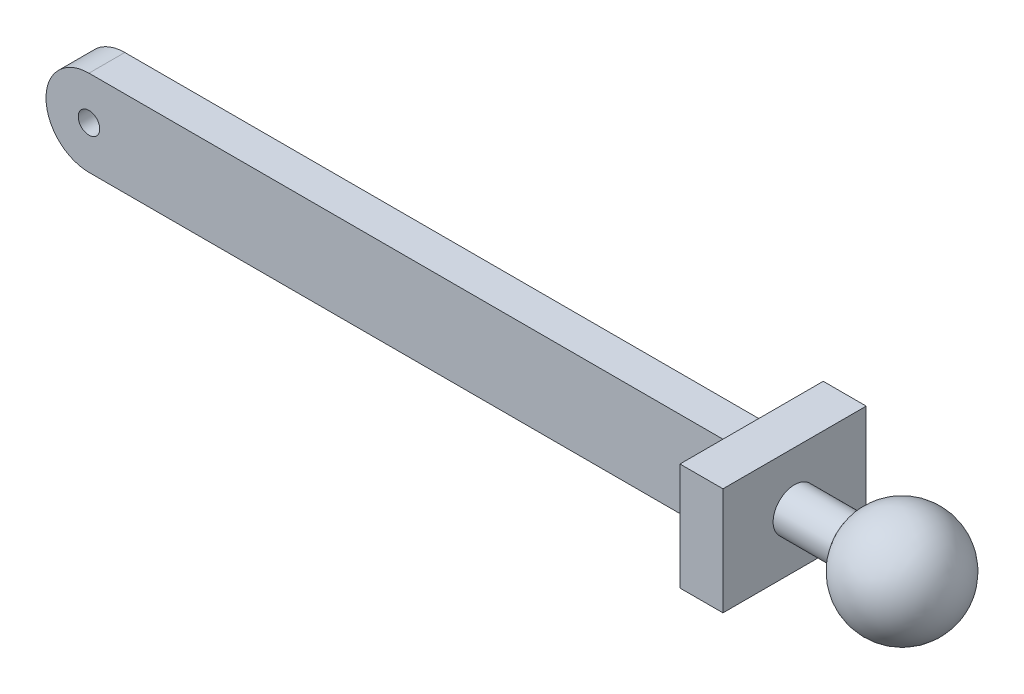
from build123d import *

# Parameters (mm, degrees)
SKETCH1_R           = 1.5
BOSS_EXTRUDE1_DEPTH = 5
FILLET3_R           = 1
BOSS_EXTRUDE2_START = 7.5
SKETCH4_W           = 6
SKETCH4_H           = 15
BOSS_EXTRUDE2_DEPTH = 20
SKETCH5_R           = 3
BOSS_EXTRUDE3_DEPTH = 15


with BuildPart() as part:
    # Sketch1 → Boss-Extrude1 (new body)
    with BuildSketch(Plane.XY):
        with BuildLine():
            ThreePointArc((0, 6), (-6, 0), (0, -6))
            Line((0, -6), (90, -6))
            ThreePointArc((90, -6), (96, 0), (90, 6))
            Line((90, 6), (0, 6))
        make_face()
        Circle(SKETCH1_R, mode=Mode.SUBTRACT)
        with Locations((90, 0)):
            Circle(SKETCH1_R, mode=Mode.SUBTRACT)
    extrude(amount=BOSS_EXTRUDE1_DEPTH)

    # Fillet3
    fillet3_edges = [part.edges().sort_by_distance(p)[0] for p in [
        (88.5, 0, 0),
    ]]
    fillet(fillet3_edges, radius=FILLET3_R)

    # Sketch4 → Boss-Extrude2 (add)
    with BuildSketch(Plane.XY.offset(5).offset(BOSS_EXTRUDE2_START)):
        with Locations((93, 0)):
            Rectangle(SKETCH4_W, SKETCH4_H)
    extrude(amount=-BOSS_EXTRUDE2_DEPTH)

    # Sketch5 → Boss-Extrude3 (add)
    with BuildSketch(Plane(origin=(96, 0, 0), x_dir=(0, 0, -1), z_dir=(1, 0, 0))):
        with Locations((-2.5, 0)):
            Circle(SKETCH5_R)
    extrude(amount=BOSS_EXTRUDE3_DEPTH)

    # Sketch6 → Revolve1 (revolve)
    with BuildSketch(Plane(origin=(111, 0, 0), x_dir=(0, 0, -1), z_dir=(1, 0, 0))):
        with BuildLine():
            Line((-2.5, 7.5), (-2.5, -7.5))
            ThreePointArc((-2.5, -7.5), (5, 0), (-2.5, 7.5))
        make_face()
    revolve(axis=Axis((111, 7.5, 2.5), (0, -1, 0)))


solid = part.part
